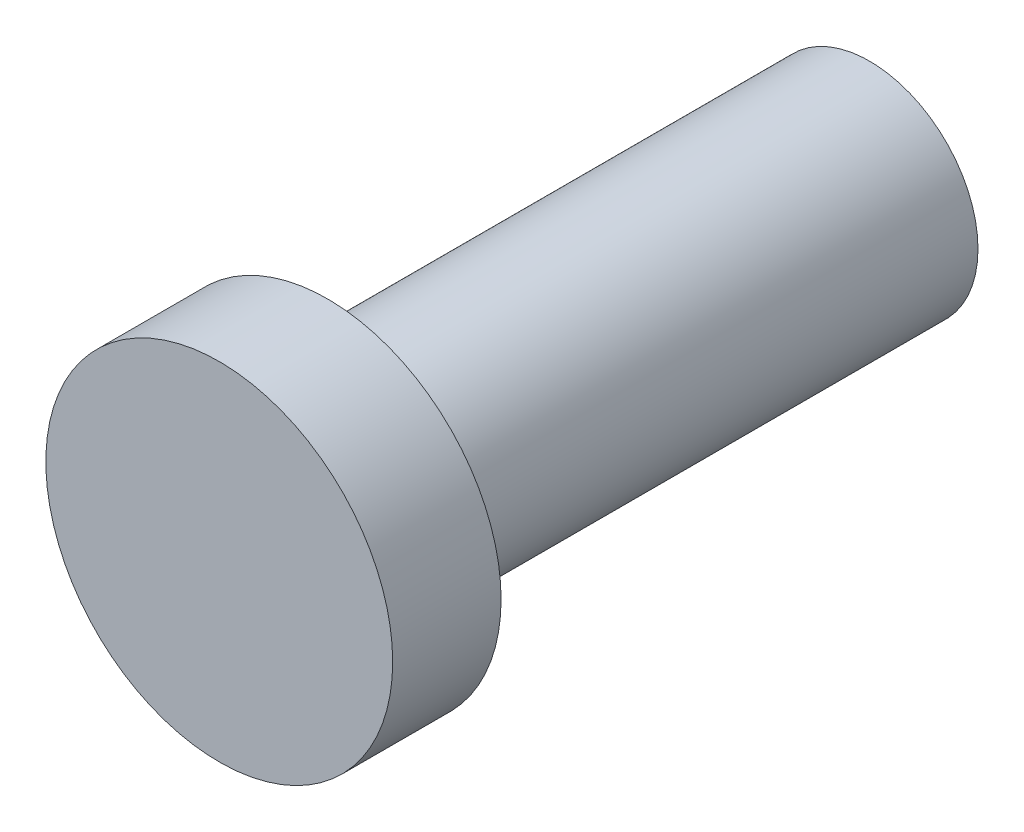
from build123d import *

# Parameters (mm, degrees)
SKETCH1_R           = 5
BOSS_EXTRUDE1_DEPTH = 25
SKETCH2_R           = 8
BOSS_EXTRUDE2_DEPTH = 5


with BuildPart() as part:
    # Sketch1 → Boss-Extrude1 (new body)
    with BuildSketch(Plane.XY):
        Circle(SKETCH1_R)
    extrude(amount=BOSS_EXTRUDE1_DEPTH)

    # Sketch2 → Boss-Extrude2 (add)
    with BuildSketch(Plane.XY.offset(25)):
        Circle(SKETCH2_R)
    extrude(amount=BOSS_EXTRUDE2_DEPTH)


solid = part.part
